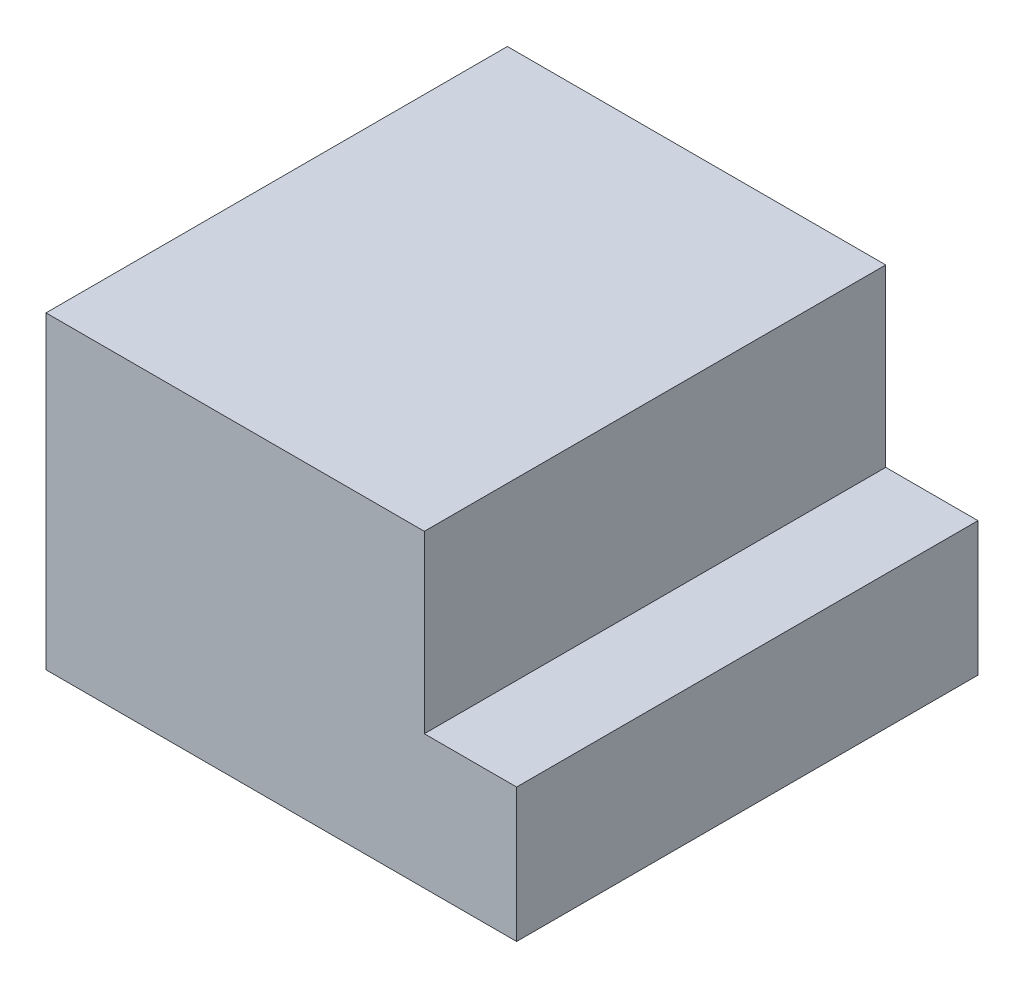
from build123d import *

# Parameters (mm, degrees)
SKETCH_1_W      = 100
SKETCH_1_H      = 67
EXTRUDE_1_DEPTH = 41
SKETCH_2_W      = 100
SKETCH_2_H      = 29
EXTRUDE_2_DEPTH = 20


with BuildPart() as part:
    # 草图1 → 凸台-拉伸1 (new, symmetric)
    with BuildSketch(Plane(origin=(0, 0, 0), x_dir=(0, 0, -1), z_dir=(1, 0, 0))):
        Rectangle(SKETCH_1_W, SKETCH_1_H)
    extrude(amount=EXTRUDE_1_DEPTH, both=True)

    # 草图2 → 凸台-拉伸2 (add)
    with BuildSketch(Plane(origin=(41, 0, 0), x_dir=(0, 0, -1), z_dir=(1, 0, 0))):
        with Locations((0, -19)):
            Rectangle(SKETCH_2_W, SKETCH_2_H)
    extrude(amount=EXTRUDE_2_DEPTH)


solid = part.part
